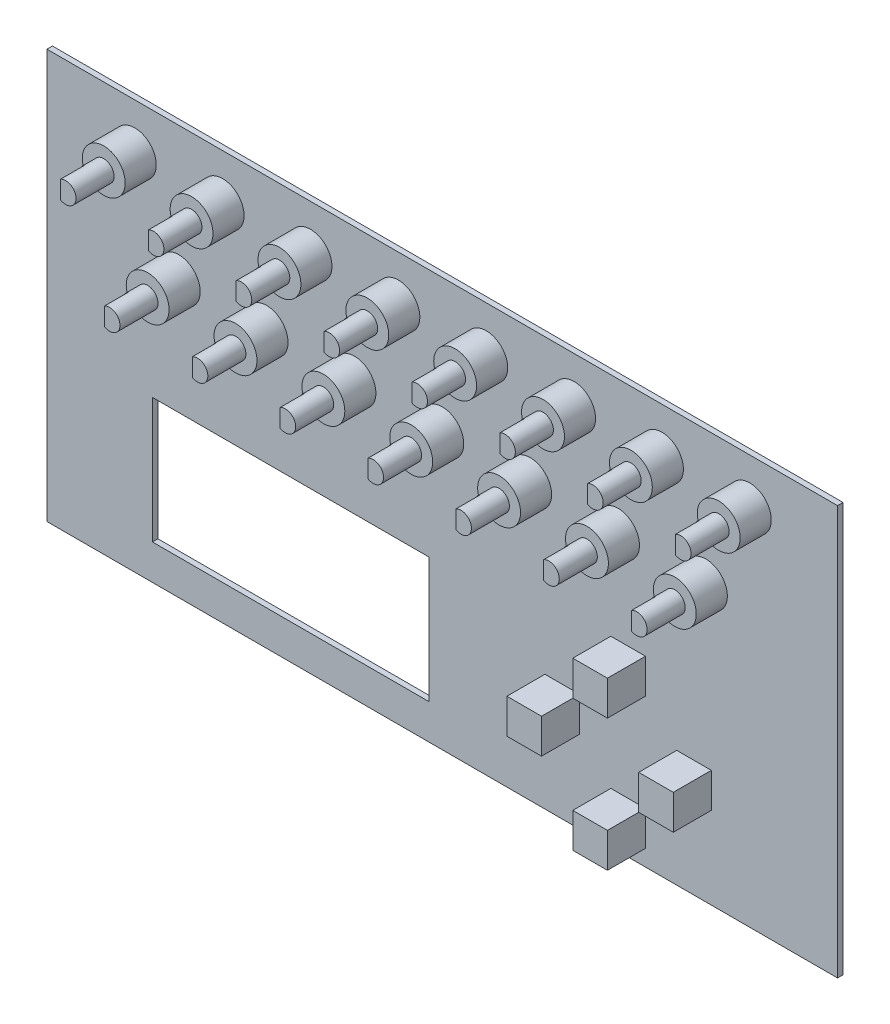
from build123d import *

# Parameters (mm, degrees)
MODEL_W              = 228.552502
MODEL_H              = 118.27002
MODEL_W_2            = 80.01
MODEL_H_2            = 36.195
BOSS_EXTRUDE3_DEPTH  = 1.5875
SKETCH4_R            = 6.1976
BOSS_EXTRUDE4_DEPTH  = 8.9916
LPATTERN1_COUNT      = 15
LPATTERN1_PITCH      = 12.7
LPATTERN1_COUNT_DIR2 = 2
LPATTERN1_PITCH_DIR2 = 25.4
SKETCH5_R            = 2.9972
BOSS_EXTRUDE5_DEPTH  = 10.9982
SKETCH8_W            = 2.447124678
SKETCH8_H            = 7.642831421
CUT_EXTRUDE1_DEPTH   = 7.0104
LPATTERN2_COUNT      = 15
LPATTERN2_PITCH      = 12.7
LPATTERN2_COUNT_DIR2 = 2
LPATTERN2_PITCH_DIR2 = 25.4
SKETCH6_W            = 10.0076
SKETCH6_H            = 10.0076
BOSS_EXTRUDE6_DEPTH  = 10.9982
LPATTERN3_COUNT      = 3
LPATTERN3_PITCH      = 19.05
LPATTERN3_COUNT_DIR2 = 2
LPATTERN3_PITCH_DIR2 = 19.05
LPATTERN4_COUNT      = 2
LPATTERN4_PITCH      = 19.05
LPATTERN4_COUNT_DIR2 = 2
LPATTERN4_PITCH_DIR2 = 19.05


with BuildPart() as part:
    # Model → Boss-Extrude3 (new body)
    with BuildSketch(Plane.XY):
        with Locations((114.276251, 46.773846)):
            Rectangle(MODEL_W, MODEL_H)
        with Locations((70.485, 15.875)):
            Rectangle(MODEL_W_2, MODEL_H_2, mode=Mode.SUBTRACT)
    extrude(amount=BOSS_EXTRUDE3_DEPTH)

    # Sketch4 → Boss-Extrude4 (add)
    with BuildSketch(Plane.XY.offset(1.5875)):
        with Locations(Location((25.4, 92.71, 0), (0, 0, 180))):
            Circle(SKETCH4_R)
    boss_extrude4 = extrude(amount=BOSS_EXTRUDE4_DEPTH)

    # LPattern1: Boss-Extrude4 15 × 2, 15 skipped
    with Locations(*[(i * LPATTERN1_PITCH, -j * LPATTERN1_PITCH_DIR2, 0) for i in range(LPATTERN1_COUNT) for j in range(LPATTERN1_COUNT_DIR2) if (i, j) not in ((0, 0), (0, 1), (1, 0), (2, 1), (3, 0), (4, 1), (5, 0), (6, 1), (7, 0), (8, 1), (9, 0), (10, 1), (11, 0), (12, 1), (13, 0), (14, 1))]):
        add(boss_extrude4)

    # Sketch5 → Boss-Extrude5 (add)
    with BuildSketch(Plane.XY.offset(10.5791)):
        with Locations((25.4, 92.71)):
            Circle(SKETCH5_R)
    boss_extrude5 = extrude(amount=BOSS_EXTRUDE5_DEPTH)

    # Sketch8 → Cut-Extrude1 (cut)
    with BuildSketch(Plane.XY.offset(21.5773)):
        with Locations((22.677837661, 92.551291415)):
            Rectangle(SKETCH8_W, SKETCH8_H)
    cut_extrude1 = extrude(amount=-CUT_EXTRUDE1_DEPTH, mode=Mode.SUBTRACT)

    # LPattern2: Boss-Extrude5, Cut-Extrude1 15 × 2, 15 skipped
    with Locations(*[(i * LPATTERN2_PITCH, -j * LPATTERN2_PITCH_DIR2, 0) for i in range(LPATTERN2_COUNT) for j in range(LPATTERN2_COUNT_DIR2) if (i, j) not in ((0, 0), (0, 1), (1, 0), (2, 1), (3, 0), (4, 1), (5, 0), (6, 1), (7, 0), (8, 1), (9, 0), (10, 1), (11, 0), (12, 1), (13, 0), (14, 1))]):
        add(boss_extrude5)
        add(cut_extrude1, mode=Mode.SUBTRACT)

    # Sketch6 → Boss-Extrude6 (add)
    with BuildSketch(Plane.XY.offset(1.5875)):
        with Locations((148.965412, 16.383)):
            Rectangle(SKETCH6_W, SKETCH6_H)
    boss_extrude6 = extrude(amount=BOSS_EXTRUDE6_DEPTH)

    # LPattern3: Boss-Extrude6 3 × 2, 3 skipped
    with Locations(*[(i * LPATTERN3_PITCH, -j * LPATTERN3_PITCH_DIR2, 0) for i in range(LPATTERN3_COUNT) for j in range(LPATTERN3_COUNT_DIR2) if (i, j) not in ((0, 0), (0, 1), (1, 0), (2, 1))]):
        add(boss_extrude6)

    # LPattern4: Boss-Extrude6 2 × 2, 2 skipped
    with Locations(*[(j * LPATTERN4_PITCH_DIR2, i * LPATTERN4_PITCH, 0) for i in range(LPATTERN4_COUNT) for j in range(LPATTERN4_COUNT_DIR2) if (i, j) not in ((0, 0), (0, 1), (1, 0))]):
        add(boss_extrude6)


solid = part.part
